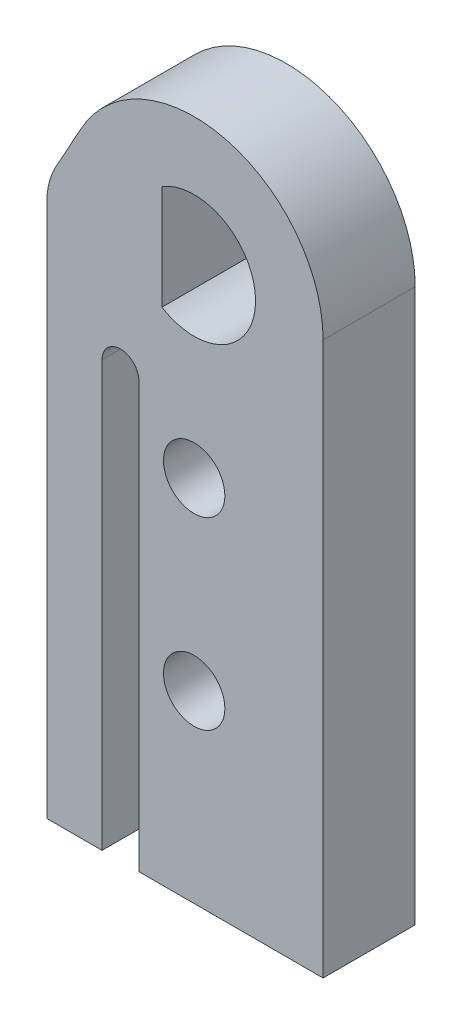
from build123d import *

# Parameters (mm, degrees)
SKETCH_1_R      = 1
EXTRUDE_2_DEPTH = 3


with BuildPart() as part:
    # 草图1 → 凸台-拉伸2 (new body)
    with BuildSketch(Plane.XY):
        with BuildLine():
            Line((-8.802114216, 25.014860267), (-8.802114216, 38.857938329))
            ThreePointArc((-8.802114216, 38.857938329), (-9.402114216, 39.457938329), (-10.002114216, 38.857938329))
            Line((-10.002114216, 38.857938329), (-10.002114216, 25.014860267))
            Line((-10.002114216, 25.014860267), (-11.802114216, 25.014860267))
            Line((-11.802114216, 25.014860267), (-11.802114216, 42.39491112))
            ThreePointArc((-11.802114216, 42.39491112), (-11.725840507, 42.995157842), (-11.501867444, 43.557252027))
            Line((-11.501867444, 43.557252027), (-10.707433177, 44.992386854))
            ThreePointArc((-10.707433177, 44.992386854), (-5.982884025, 47.089313582), (-2.802114216, 43.014860267))
            Line((-2.802114216, 43.014860267), (-2.802114216, 25.014860267))
            Line((-2.802114216, 25.014860267), (-8.802114216, 25.014860267))
        make_face()
        with Locations((-7.002114216, 37.014860267)):
            Circle(SKETCH_1_R, mode=Mode.SUBTRACT)
        with Locations((-7.002114216, 31.014860267)):
            Circle(SKETCH_1_R, mode=Mode.SUBTRACT)
        with BuildLine():
            Line((-8.052114216, 43.014860267), (-8.052114216, 41.312655814))
            ThreePointArc((-8.052114216, 41.312655814), (-5.002114216, 43.014860267), (-8.052114216, 44.71706472))
            Line((-8.052114216, 44.71706472), (-8.052114216, 43.014860267))
        make_face(mode=Mode.SUBTRACT)
    extrude(amount=EXTRUDE_2_DEPTH)


solid = part.part
